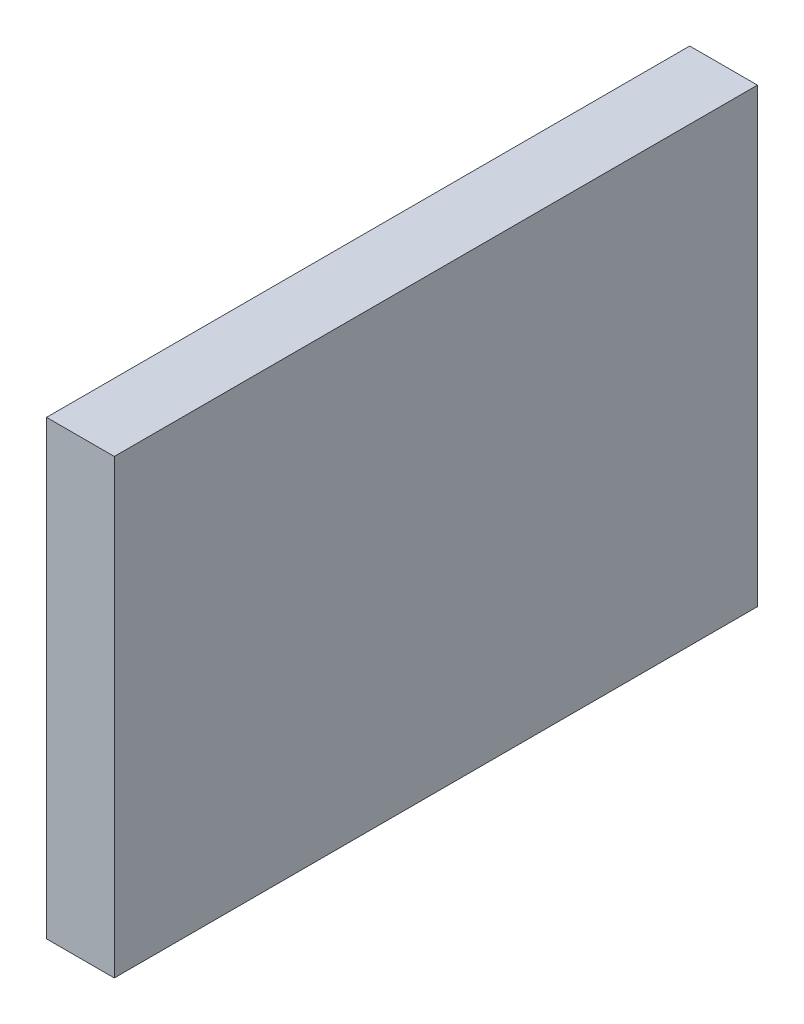
from build123d import *

# Parameters (mm, degrees)
CROQUIS1_W              = 142.4
CROQUIS1_H              = 100
SALIENTE_EXTRUIR1_DEPTH = 15


with BuildPart() as part:
    # Croquis1 → Saliente-Extruir1 (new body)
    with BuildSketch(Plane(origin=(0, 0, 0), x_dir=(0, 0, -1), z_dir=(1, 0, 0))):
        with Locations((71.2, 50)):
            Rectangle(CROQUIS1_W, CROQUIS1_H)
    extrude(amount=SALIENTE_EXTRUIR1_DEPTH)


solid = part.part
